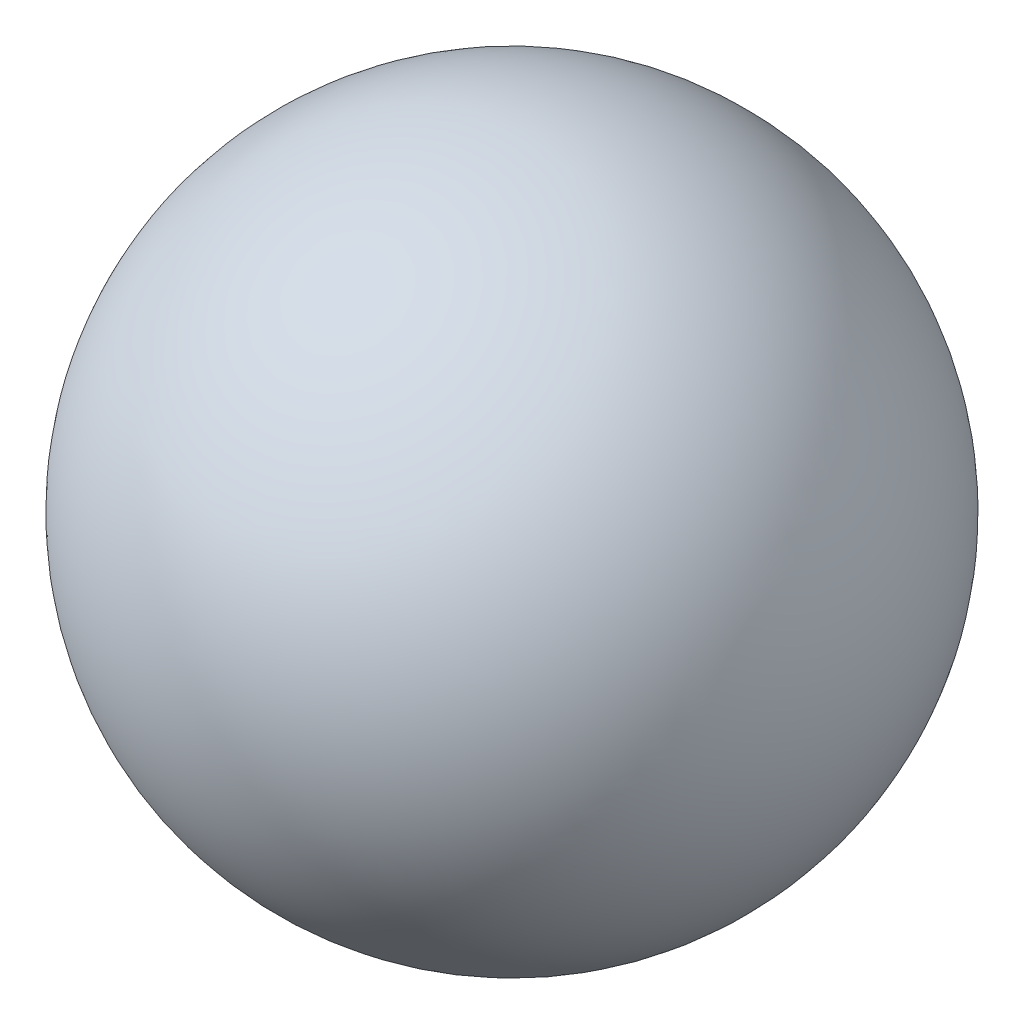
from build123d import *

# Parameters (mm, degrees)
SCALE1_SCALE = 0.193040386


with BuildPart() as part:
    # Sketch1 → Revolve1 (revolve)
    with BuildSketch(Plane.XY):
        with BuildLine():
            Line((-12, 0), (12, 0))
            ThreePointArc((12, 0), (0, -12), (-12, 0))
        make_face()
    revolve(axis=Axis((-12, 0, 0), (1, 0, 0)))


with BuildPart() as part_1:
    # Scale1: scaled about (0, 0, 0)
    add(part.part.scale(SCALE1_SCALE))


solid = part_1.part
